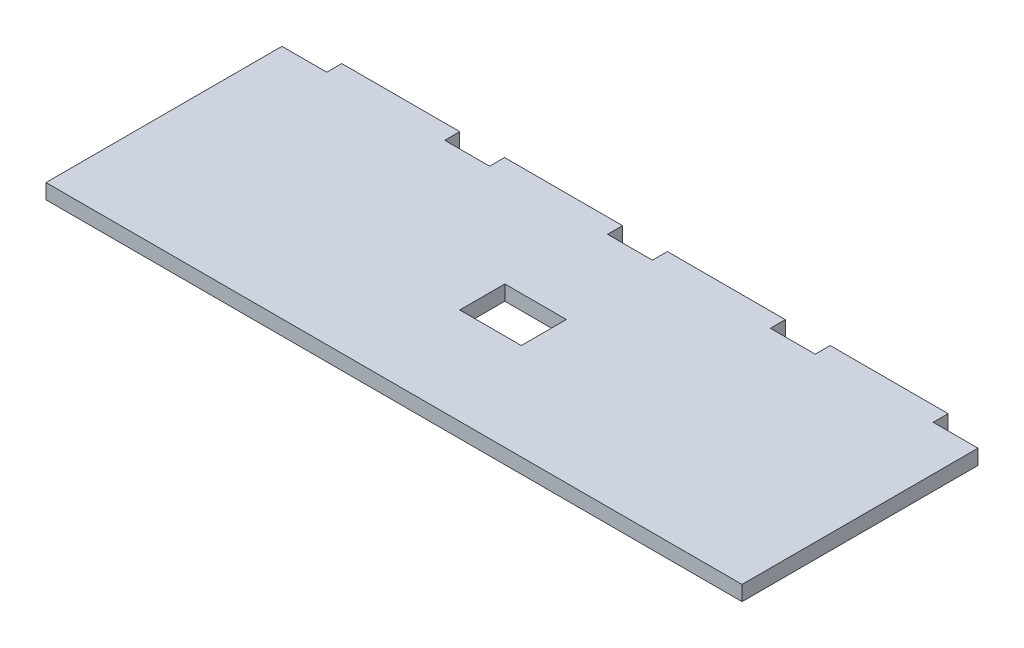
from build123d import *

# Parameters (mm, degrees)
SKETCH1_W           = 26.1
SKETCH1_H           = 19.1
BOSS_EXTRUDE1_DEPTH = 6.35


with BuildPart() as part:
    # Sketch1 → Boss-Extrude1 (new body)
    with BuildSketch(Plane(origin=(0, 0, 0), x_dir=(1, 0, 0), z_dir=(0, 1, 0))):
        Polygon((0, 0), (0, -100), (295, -100), (295, 0), (276, 0), (276, 6.35), (226, 6.35), (226, 0), (207, 0), (207, 6.35), (157, 6.35), (157, 0), (138, 0), (138, 6.35), (88, 6.35), (88, 0), (69, 0), (69, 6.35), (19, 6.35), (19, 0), align=None)
        with Locations((147.5, -49.55)):
            Rectangle(SKETCH1_W, SKETCH1_H, mode=Mode.SUBTRACT)
    extrude(amount=BOSS_EXTRUDE1_DEPTH)


solid = part.part
